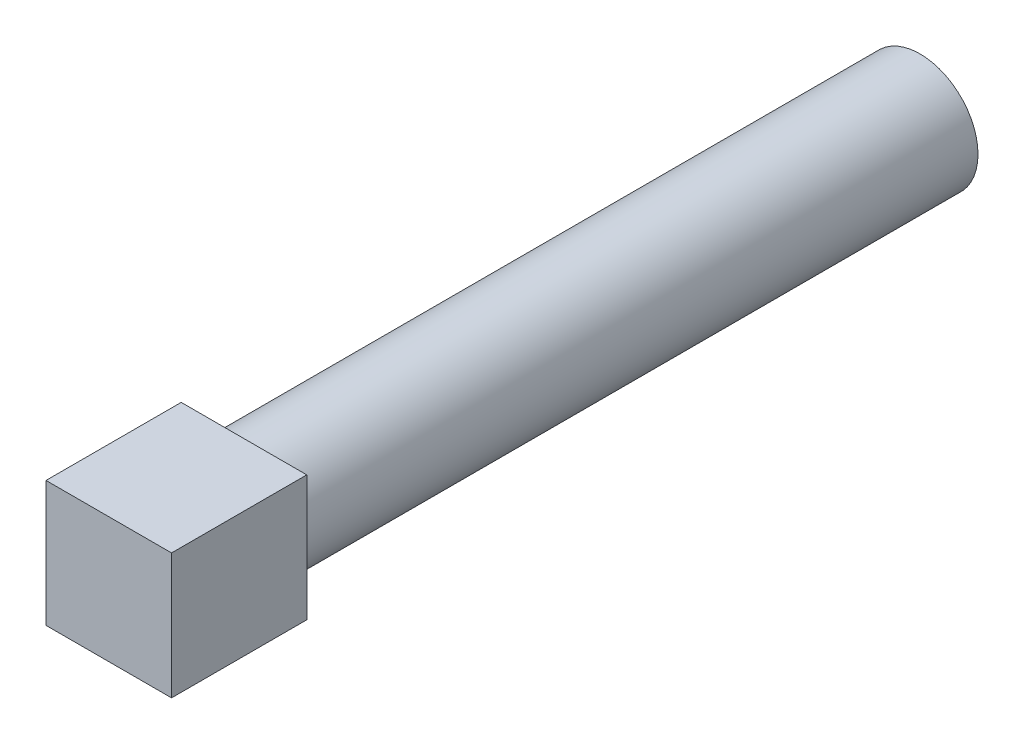
from build123d import *

# Parameters (mm, degrees)
SKETCH1_R           = 6
BOSS_EXTRUDE1_DEPTH = 70
SKETCH2_W           = 13
SKETCH2_H           = 13
BOSS_EXTRUDE2_DEPTH = 14


with BuildPart() as part:
    # Sketch1 → Boss-Extrude1 (new body)
    with BuildSketch(Plane.XY):
        Circle(SKETCH1_R)
    extrude(amount=BOSS_EXTRUDE1_DEPTH)

    # Sketch2 → Boss-Extrude2 (add)
    with BuildSketch(Plane.XY.offset(84)):
        Rectangle(SKETCH2_W, SKETCH2_H)
    extrude(amount=-BOSS_EXTRUDE2_DEPTH)


solid = part.part
